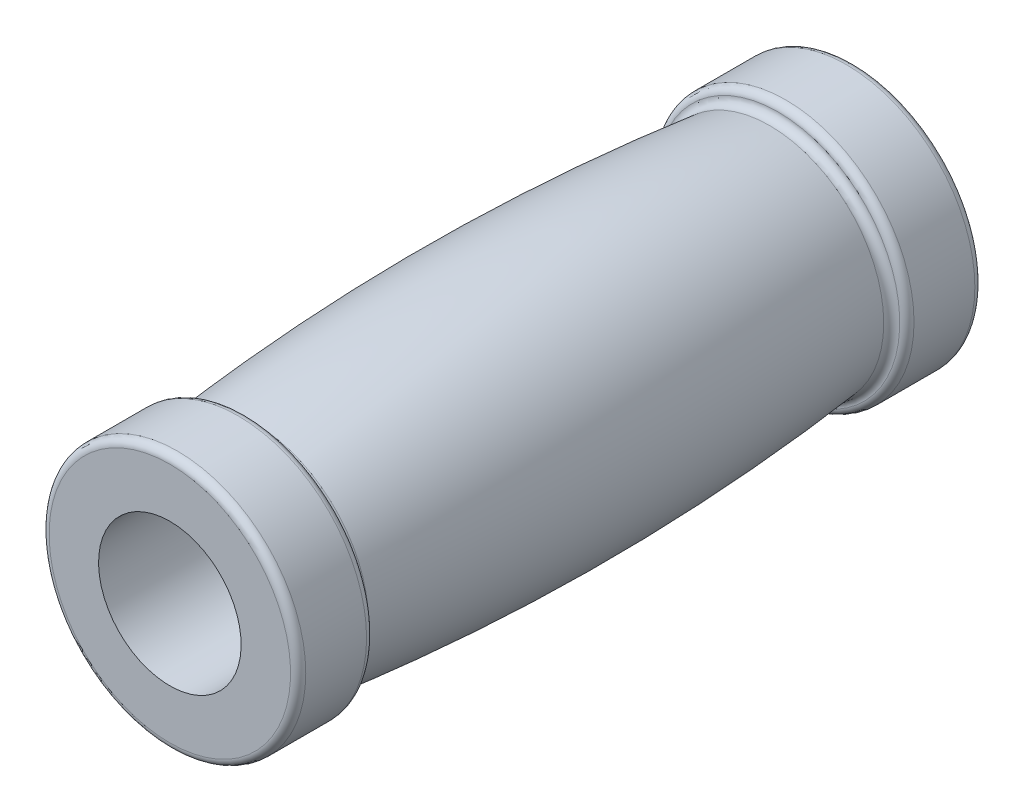
from build123d import *


with BuildPart() as part:
    # Sketch2 → Revolve1 (revolve)
    with BuildSketch(Plane(origin=(0, 0, 0), x_dir=(0, 0, -1), z_dir=(1, 0, 0))):
        with BuildLine():
            Line((-57.15, 20.16125), (-57.15, 11.90625))
            Line((-57.15, 11.90625), (57.15, 11.90625))
            Line((57.15, 11.90625), (57.15, 20.16125))
            ThreePointArc((57.15, 20.16125), (56.778025612, 21.059275612), (55.88, 21.43125))
            Line((55.88, 21.43125), (45.72, 21.43125))
            ThreePointArc((45.72, 21.43125), (44.821974388, 21.059275612), (44.45, 20.16125))
            Line((44.45, 20.16125), (44.45, 20.312248712))
            ThreePointArc((44.45, 20.312248712), (44.02704551, 19.365985587), (43.039899365, 19.05))
            ThreePointArc((43.039899365, 19.05), (0, 21.43125), (-43.039899365, 19.05))
            ThreePointArc((-43.039899365, 19.05), (-44.02704551, 19.365985587), (-44.45, 20.312248712))
            Line((-44.45, 20.312248712), (-44.45, 20.16125))
            ThreePointArc((-44.45, 20.16125), (-44.821974388, 21.059275612), (-45.72, 21.43125))
            Line((-45.72, 21.43125), (-55.88, 21.43125))
            ThreePointArc((-55.88, 21.43125), (-56.778025612, 21.059275612), (-57.15, 20.16125))
        make_face()
    revolve(axis=Axis((0, 0, -57.15), (0, 0, 1)))


solid = part.part
